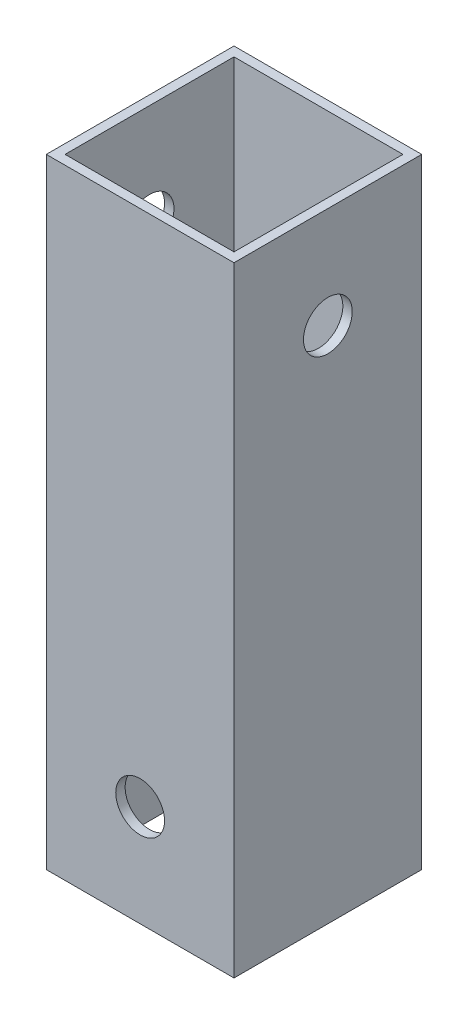
from build123d import *

# Parameters (mm, degrees)
SKETCH1_W           = 20
SKETCH1_H           = 20
SKETCH1_W_2         = 18
SKETCH1_H_2         = 18
BOSS_EXTRUDE1_DEPTH = 66
SKETCH2_R           = 2.6
CUT_EXTRUDE1_DEPTH  = 66
SKETCH3_R           = 2.6
CUT_EXTRUDE2_DEPTH  = 66


with BuildPart() as part:
    # Sketch1 → Boss-Extrude1 (new body)
    with BuildSketch(Plane(origin=(0, 0, 0), x_dir=(1, 0, 0), z_dir=(0, 1, 0))):
        with Locations((10, 10)):
            Rectangle(SKETCH1_W, SKETCH1_H)
        with Locations((10, 10)):
            Rectangle(SKETCH1_W_2, SKETCH1_H_2, mode=Mode.SUBTRACT)
    extrude(amount=BOSS_EXTRUDE1_DEPTH)

    # Sketch2 → Cut-Extrude1 (cut)
    with BuildSketch(Plane(origin=(20, 0, 0), x_dir=(0, 0, -1), z_dir=(1, 0, 0))):
        with Locations((10, 55.2)):
            Circle(SKETCH2_R)
    extrude(amount=-CUT_EXTRUDE1_DEPTH, mode=Mode.SUBTRACT)

    # Sketch3 → Cut-Extrude2 (cut)
    with BuildSketch(Plane(origin=(0, 0, -20), x_dir=(-1, 0, 0), z_dir=(0, 0, -1))):
        with Locations((-10, 10.8)):
            Circle(SKETCH3_R)
    extrude(amount=-CUT_EXTRUDE2_DEPTH, mode=Mode.SUBTRACT)


solid = part.part
